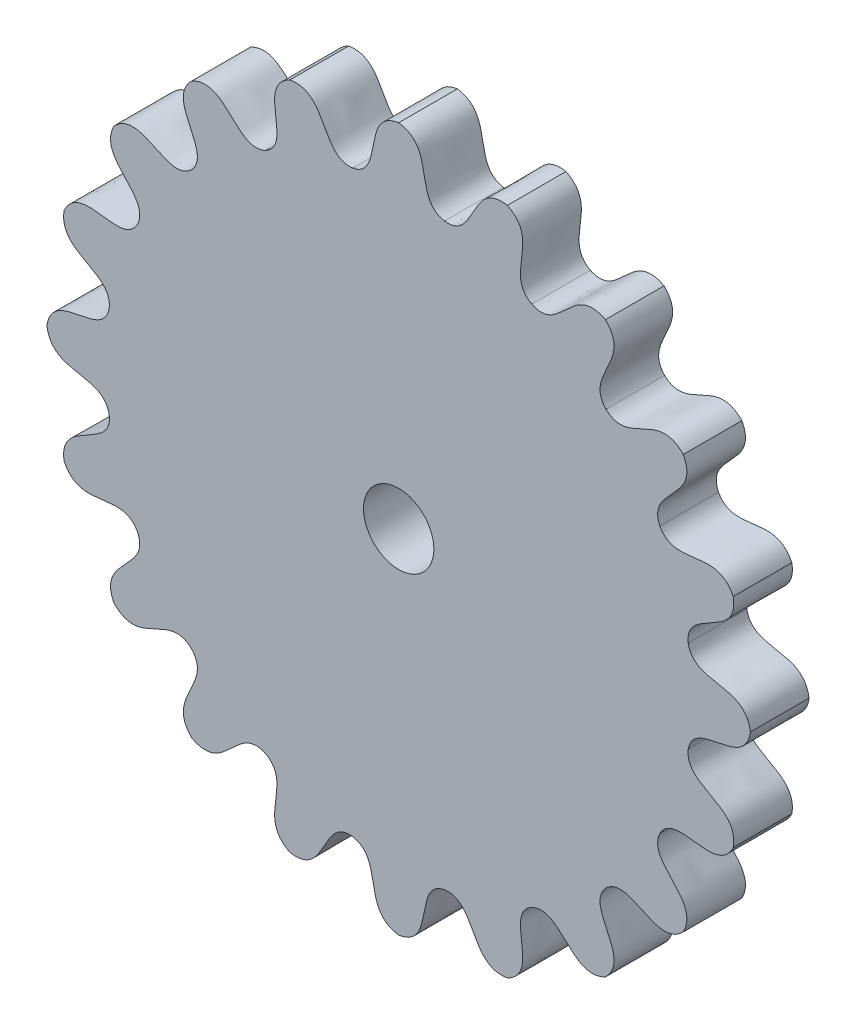
from build123d import *

# Parameters (mm, degrees)
SKETCH1_R           = 3
BOSS_EXTRUDE1_DEPTH = 5


with BuildPart() as part:
    # Sketch1 → Boss-Extrude1 (new body)
    with BuildSketch(Plane.XY):
        with BuildLine():
            add(Edge.make_bspline(
                [(0, 30), (3.243669136, 29.514932873), (1.18511812, 25.21974269), (3.910973785, 24.69291666)],
                knots=[0, 0, 0, 0, 0.984502581, 0.984502581, 0.984502581, 0.984502581], degree=3))
            add(Edge.make_bspline(
                [(0, 30), (-3.243669136, 29.514932873), (-1.18511812, 25.21974269), (-3.910973785, 24.69291666)],
                knots=[0, 0, 0, 0, 0.984502581, 0.984502581, 0.984502581, 0.984502581], degree=3))
            add(Edge.make_bspline(
                [(-9.270509831, 28.531695489), (-6.035703177, 29.072718124), (-6.666214775, 24.351622264), (-3.910973785, 24.69291666)],
                knots=[0, 0, 0, 0, 0.984502581, 0.984502581, 0.984502581, 0.984502581], degree=3))
            add(Edge.make_bspline(
                [(-9.270509831, 28.531695489), (-12.205528514, 27.06802035), (-8.920443395, 23.619178985), (-11.350087992, 22.275801932)],
                knots=[0, 0, 0, 0, 0.984502581, 0.984502581, 0.984502581, 0.984502581], degree=3))
            add(Edge.make_bspline(
                [(-17.633557569, 24.270509831), (-14.72425881, 25.784663164), (-13.865012121, 21.099795383), (-11.350087992, 22.275801932)],
                knots=[0, 0, 0, 0, 0.984502581, 0.984502581, 0.984502581, 0.984502581], degree=3))
            add(Edge.make_bspline(
                [(-17.633557569, 24.270509831), (-19.972625721, 21.971501401), (-15.782573519, 19.706605477), (-17.678176506, 17.678176506)],
                knots=[0, 0, 0, 0, 0.984502581, 0.984502581, 0.984502581, 0.984502581], degree=3))
            add(Edge.make_bspline(
                [(-24.270509831, 17.633557569), (-21.971501401, 19.972625721), (-19.706605477, 15.782573519), (-17.678176506, 17.678176506)],
                knots=[0, 0, 0, 0, 0.984502581, 0.984502581, 0.984502581, 0.984502581], degree=3))
            add(Edge.make_bspline(
                [(-24.270509831, 17.633557569), (-25.784663164, 14.72425881), (-21.099795383, 13.865012121), (-22.275801932, 11.350087992)],
                knots=[0, 0, 0, 0, 0.984502581, 0.984502581, 0.984502581, 0.984502581], degree=3))
            add(Edge.make_bspline(
                [(-28.531695489, 9.270509831), (-27.06802035, 12.205528514), (-23.619178985, 8.920443395), (-22.275801932, 11.350087992)],
                knots=[0, 0, 0, 0, 0.984502581, 0.984502581, 0.984502581, 0.984502581], degree=3))
            add(Edge.make_bspline(
                [(-28.531695489, 9.270509831), (-29.072718124, 6.035703177), (-24.351622264, 6.666214775), (-24.69291666, 3.910973785)],
                knots=[0, 0, 0, 0, 0.984502581, 0.984502581, 0.984502581, 0.984502581], degree=3))
            add(Edge.make_bspline(
                [(-30, 0), (-29.514932873, 3.243669136), (-25.21974269, 1.18511812), (-24.69291666, 3.910973785)],
                knots=[0, 0, 0, 0, 0.984502581, 0.984502581, 0.984502581, 0.984502581], degree=3))
            add(Edge.make_bspline(
                [(-30, 0), (-29.514932873, -3.243669136), (-25.21974269, -1.18511812), (-24.69291666, -3.910973785)],
                knots=[0, 0, 0, 0, 0.984502581, 0.984502581, 0.984502581, 0.984502581], degree=3))
            add(Edge.make_bspline(
                [(-28.531695489, -9.270509831), (-29.072718124, -6.035703177), (-24.351622264, -6.666214775), (-24.69291666, -3.910973785)],
                knots=[0, 0, 0, 0, 0.984502581, 0.984502581, 0.984502581, 0.984502581], degree=3))
            add(Edge.make_bspline(
                [(-28.531695489, -9.270509831), (-27.06802035, -12.205528514), (-23.619178985, -8.920443395), (-22.275801932, -11.350087992)],
                knots=[0, 0, 0, 0, 0.984502581, 0.984502581, 0.984502581, 0.984502581], degree=3))
            add(Edge.make_bspline(
                [(-24.270509831, -17.633557569), (-25.784663164, -14.72425881), (-21.099795383, -13.865012121), (-22.275801932, -11.350087992)],
                knots=[0, 0, 0, 0, 0.984502581, 0.984502581, 0.984502581, 0.984502581], degree=3))
            add(Edge.make_bspline(
                [(-24.270509831, -17.633557569), (-21.971501401, -19.972625721), (-19.706605477, -15.782573519), (-17.678176506, -17.678176506)],
                knots=[0, 0, 0, 0, 0.984502581, 0.984502581, 0.984502581, 0.984502581], degree=3))
            add(Edge.make_bspline(
                [(-17.633557569, -24.270509831), (-19.972625721, -21.971501401), (-15.782573519, -19.706605477), (-17.678176506, -17.678176506)],
                knots=[0, 0, 0, 0, 0.984502581, 0.984502581, 0.984502581, 0.984502581], degree=3))
            add(Edge.make_bspline(
                [(-17.633557569, -24.270509831), (-14.72425881, -25.784663164), (-13.865012121, -21.099795383), (-11.350087992, -22.275801932)],
                knots=[0, 0, 0, 0, 0.984502581, 0.984502581, 0.984502581, 0.984502581], degree=3))
            add(Edge.make_bspline(
                [(-9.270509831, -28.531695489), (-12.205528514, -27.06802035), (-8.920443395, -23.619178985), (-11.350087992, -22.275801932)],
                knots=[0, 0, 0, 0, 0.984502581, 0.984502581, 0.984502581, 0.984502581], degree=3))
            add(Edge.make_bspline(
                [(-9.270509831, -28.531695489), (-6.035703177, -29.072718124), (-6.666214775, -24.351622264), (-3.910973785, -24.69291666)],
                knots=[0, 0, 0, 0, 0.984502581, 0.984502581, 0.984502581, 0.984502581], degree=3))
            add(Edge.make_bspline(
                [(0, -30), (-3.243669136, -29.514932873), (-1.18511812, -25.21974269), (-3.910973785, -24.69291666)],
                knots=[0, 0, 0, 0, 0.984502581, 0.984502581, 0.984502581, 0.984502581], degree=3))
            add(Edge.make_bspline(
                [(0, -30), (3.243669136, -29.514932873), (1.18511812, -25.21974269), (3.910973785, -24.69291666)],
                knots=[0, 0, 0, 0, 0.984502581, 0.984502581, 0.984502581, 0.984502581], degree=3))
            add(Edge.make_bspline(
                [(9.270509831, -28.531695489), (6.035703177, -29.072718124), (6.666214775, -24.351622264), (3.910973785, -24.69291666)],
                knots=[0, 0, 0, 0, 0.984502581, 0.984502581, 0.984502581, 0.984502581], degree=3))
            add(Edge.make_bspline(
                [(9.270509831, -28.531695489), (12.205528514, -27.06802035), (8.920443395, -23.619178985), (11.350087992, -22.275801932)],
                knots=[0, 0, 0, 0, 0.984502581, 0.984502581, 0.984502581, 0.984502581], degree=3))
            add(Edge.make_bspline(
                [(17.633557569, -24.270509831), (14.72425881, -25.784663164), (13.865012121, -21.099795383), (11.350087992, -22.275801932)],
                knots=[0, 0, 0, 0, 0.984502581, 0.984502581, 0.984502581, 0.984502581], degree=3))
            add(Edge.make_bspline(
                [(17.633557569, -24.270509831), (19.972625721, -21.971501401), (15.782573519, -19.706605477), (17.678176506, -17.678176506)],
                knots=[0, 0, 0, 0, 0.984502581, 0.984502581, 0.984502581, 0.984502581], degree=3))
            add(Edge.make_bspline(
                [(24.270509831, -17.633557569), (21.971501401, -19.972625721), (19.706605477, -15.782573519), (17.678176506, -17.678176506)],
                knots=[0, 0, 0, 0, 0.984502581, 0.984502581, 0.984502581, 0.984502581], degree=3))
            add(Edge.make_bspline(
                [(24.270509831, -17.633557569), (25.784663164, -14.72425881), (21.099795383, -13.865012121), (22.275801932, -11.350087992)],
                knots=[0, 0, 0, 0, 0.984502581, 0.984502581, 0.984502581, 0.984502581], degree=3))
            add(Edge.make_bspline(
                [(28.531695489, -9.270509831), (27.06802035, -12.205528514), (23.619178985, -8.920443395), (22.275801932, -11.350087992)],
                knots=[0, 0, 0, 0, 0.984502581, 0.984502581, 0.984502581, 0.984502581], degree=3))
            add(Edge.make_bspline(
                [(28.531695489, -9.270509831), (29.072718124, -6.035703177), (24.351622264, -6.666214775), (24.69291666, -3.910973785)],
                knots=[0, 0, 0, 0, 0.984502581, 0.984502581, 0.984502581, 0.984502581], degree=3))
            add(Edge.make_bspline(
                [(30, 0), (29.514932873, -3.243669136), (25.21974269, -1.18511812), (24.69291666, -3.910973785)],
                knots=[0, 0, 0, 0, 0.984502581, 0.984502581, 0.984502581, 0.984502581], degree=3))
            add(Edge.make_bspline(
                [(30, 0), (29.514932873, 3.243669136), (25.21974269, 1.18511812), (24.69291666, 3.910973785)],
                knots=[0, 0, 0, 0, 0.984502581, 0.984502581, 0.984502581, 0.984502581], degree=3))
            add(Edge.make_bspline(
                [(28.531695489, 9.270509831), (29.072718124, 6.035703177), (24.351622264, 6.666214775), (24.69291666, 3.910973785)],
                knots=[0, 0, 0, 0, 0.984502581, 0.984502581, 0.984502581, 0.984502581], degree=3))
            add(Edge.make_bspline(
                [(28.531695489, 9.270509831), (27.06802035, 12.205528514), (23.619178985, 8.920443395), (22.275801932, 11.350087992)],
                knots=[0, 0, 0, 0, 0.984502581, 0.984502581, 0.984502581, 0.984502581], degree=3))
            add(Edge.make_bspline(
                [(24.270509831, 17.633557569), (25.784663164, 14.72425881), (21.099795383, 13.865012121), (22.275801932, 11.350087992)],
                knots=[0, 0, 0, 0, 0.984502581, 0.984502581, 0.984502581, 0.984502581], degree=3))
            add(Edge.make_bspline(
                [(24.270509831, 17.633557569), (21.971501401, 19.972625721), (19.706605477, 15.782573519), (17.678176506, 17.678176506)],
                knots=[0, 0, 0, 0, 0.984502581, 0.984502581, 0.984502581, 0.984502581], degree=3))
            add(Edge.make_bspline(
                [(17.633557569, 24.270509831), (19.972625721, 21.971501401), (15.782573519, 19.706605477), (17.678176506, 17.678176506)],
                knots=[0, 0, 0, 0, 0.984502581, 0.984502581, 0.984502581, 0.984502581], degree=3))
            add(Edge.make_bspline(
                [(17.633557569, 24.270509831), (14.72425881, 25.784663164), (13.865012121, 21.099795383), (11.350087992, 22.275801932)],
                knots=[0, 0, 0, 0, 0.984502581, 0.984502581, 0.984502581, 0.984502581], degree=3))
            add(Edge.make_bspline(
                [(9.270509831, 28.531695489), (12.205528514, 27.06802035), (8.920443395, 23.619178985), (11.350087992, 22.275801932)],
                knots=[0, 0, 0, 0, 0.984502581, 0.984502581, 0.984502581, 0.984502581], degree=3))
            add(Edge.make_bspline(
                [(9.270509831, 28.531695489), (6.035703177, 29.072718124), (6.666214775, 24.351622264), (3.910973785, 24.69291666)],
                knots=[0, 0, 0, 0, 0.984502581, 0.984502581, 0.984502581, 0.984502581], degree=3))
        make_face()
        Circle(SKETCH1_R, mode=Mode.SUBTRACT)
    extrude(amount=BOSS_EXTRUDE1_DEPTH)


solid = part.part
